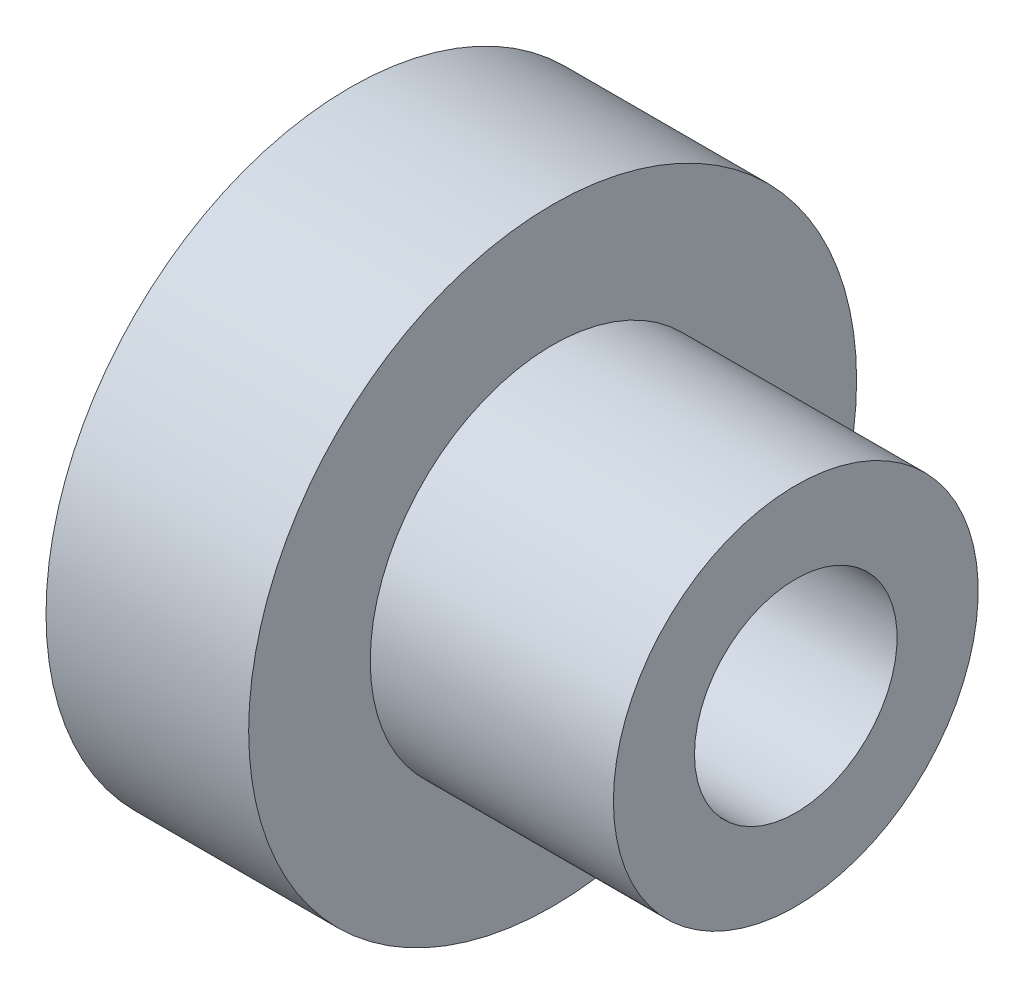
from build123d import *


with BuildPart() as part:
    # Sketch1 → Revolve1 (revolve)
    with BuildSketch(Plane.XY, mode=Mode.PRIVATE) as revolve1_sk:
        Polygon((0, 2.5), (0, 7.5), (5, 7.5), (5, 4.5), (11, 4.5), (11, 2.5), align=None)
    revolve(revolve1_sk.sketch.rotate(Axis((0, 0, 0), (1, 0, 0)), 90), axis=Axis((0, 0, 0), (1, 0, 0)))


solid = part.part
